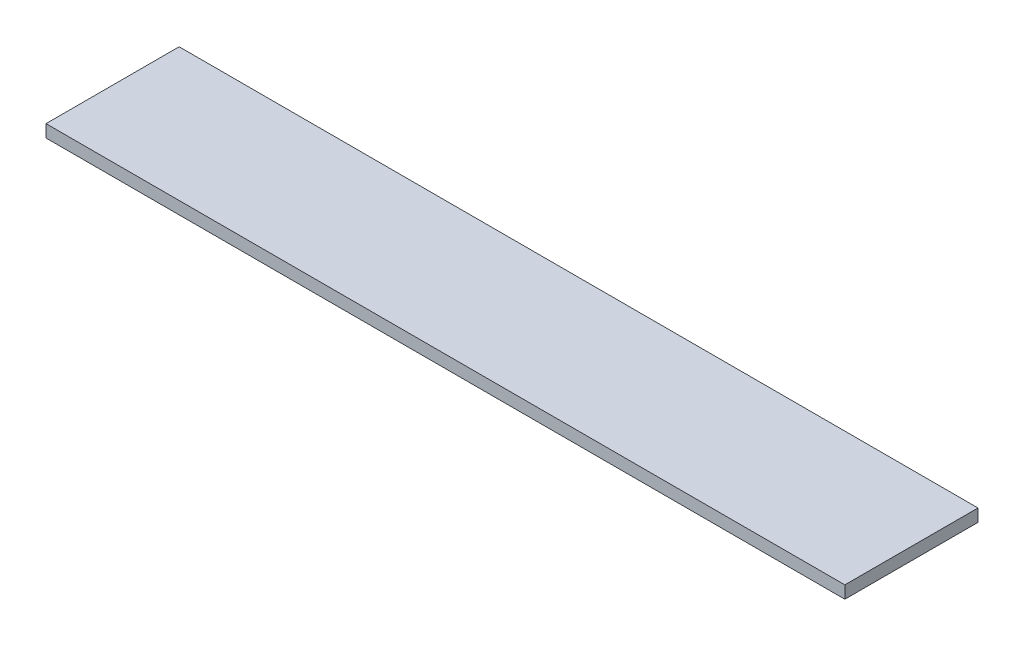
from build123d import *

# Parameters (mm, degrees)
SKETCH1_W           = 1219.2
SKETCH1_H           = 203.2
BOSS_EXTRUDE1_DEPTH = 19.05


with BuildPart() as part:
    # Sketch1 → Boss-Extrude1 (new body)
    with BuildSketch(Plane(origin=(0, 0, 0), x_dir=(1, 0, 0), z_dir=(0, 1, 0))):
        Rectangle(SKETCH1_W, SKETCH1_H)
    extrude(amount=BOSS_EXTRUDE1_DEPTH)


solid = part.part
